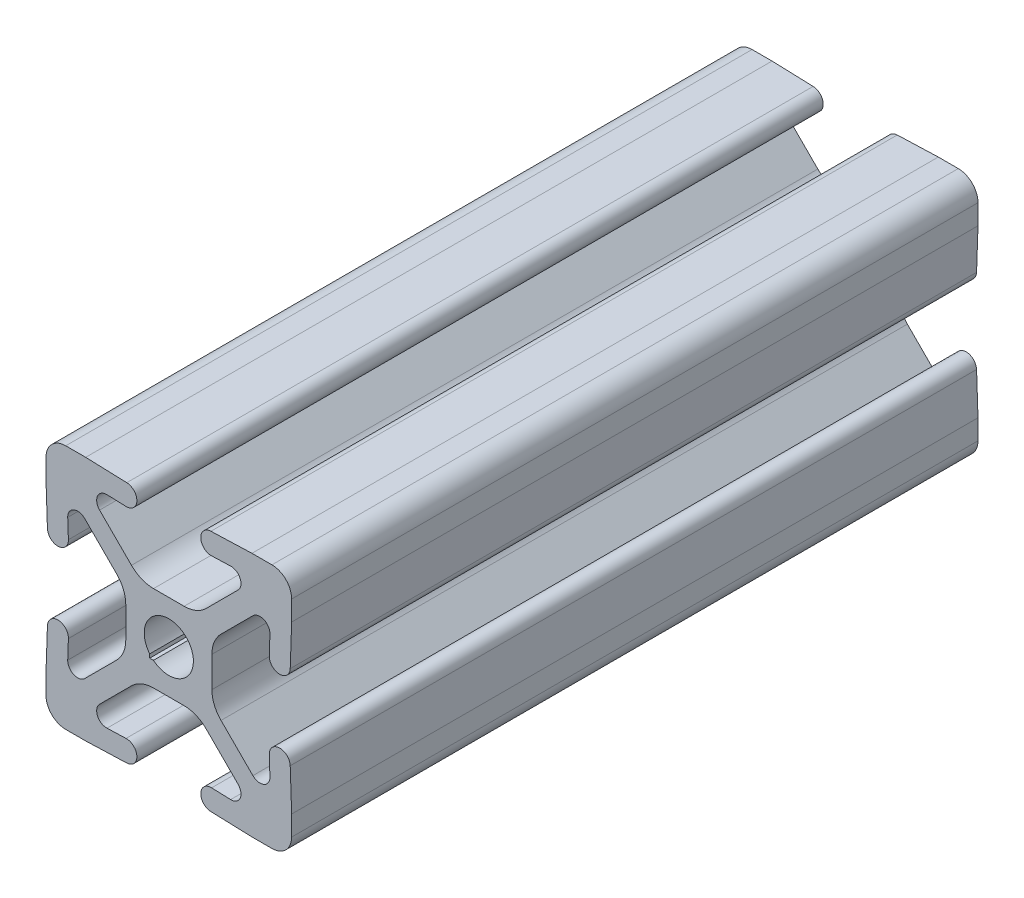
from build123d import *

# Parameters (mm, degrees)
BOSS_EXTRUDE1_DEPTH = 69.85


with BuildPart() as part:
    # Model → Boss-Extrude1 (new body)
    with BuildSketch(Plane.XY):
        with BuildLine():
            Line((50.659960212, 72.999871414), (53.774553856, 72.999871414))
            ThreePointArc((53.774553856, 72.999871414), (54.989573754, 72.758188929), (56.019617887, 72.069935444))
            Line((56.019617887, 72.069935444), (59.264200891, 68.825352439))
            ThreePointArc((59.264200891, 68.825352439), (59.477513437, 67.701802895), (58.510322513, 67.091550869))
            Line((58.510322513, 67.091550869), (56.572487817, 67.159221548))
            ThreePointArc((56.572487817, 67.159221548), (55.4691069, 66.130302197), (56.498026251, 65.026921279))
            Line((56.498026251, 65.026921279), (60.677257034, 64.880979325))
            Line((60.677257034, 64.880979325), (62.710657034, 64.880979325))
            ThreePointArc((62.710657034, 64.880979325), (64.129537501, 65.468698857), (64.717257034, 66.887579325))
            Line((64.717257034, 66.887579325), (64.717257034, 68.920979325))
            Line((64.717257034, 68.920979325), (64.57131508, 73.100210108))
            ThreePointArc((64.57131508, 73.100210108), (63.467934162, 74.129129459), (62.439014811, 73.025748542))
            Line((62.439014811, 73.025748542), (62.50668549, 71.087913846))
            ThreePointArc((62.50668549, 71.087913846), (61.896433464, 70.120722922), (60.77288392, 70.334035468))
            Line((60.77288392, 70.334035468), (57.528300915, 73.578618472))
            ThreePointArc((57.528300915, 73.578618472), (56.84004743, 74.608662605), (56.598364945, 75.823682503))
            Line((56.598364945, 75.823682503), (56.598364945, 78.938276147))
            ThreePointArc((56.598364945, 78.938276147), (56.84004743, 80.153296044), (57.528300915, 81.183340177))
            Line((57.528300915, 81.183340177), (60.77288392, 84.427923182))
            ThreePointArc((60.77288392, 84.427923182), (61.896433464, 84.641235728), (62.50668549, 83.674044803))
            Line((62.50668549, 83.674044803), (62.439014811, 81.736210108))
            ThreePointArc((62.439014811, 81.736210108), (63.467934162, 80.63282919), (64.57131508, 81.661748542))
            Line((64.57131508, 81.661748542), (64.717257034, 85.840979325))
            Line((64.717257034, 85.840979325), (64.717257034, 87.874379325))
            ThreePointArc((64.717257034, 87.874379325), (64.129537501, 89.293259792), (62.710657034, 89.880979325))
            Line((62.710657034, 89.880979325), (60.677257034, 89.880979325))
            Line((60.677257034, 89.880979325), (56.498026251, 89.73503737))
            ThreePointArc((56.498026251, 89.73503737), (55.4691069, 88.631656452), (56.572487817, 87.602737101))
            Line((56.572487817, 87.602737101), (58.510322513, 87.67040778))
            ThreePointArc((58.510322513, 87.67040778), (59.477513437, 87.060155754), (59.264200891, 85.93660621))
            Line((59.264200891, 85.93660621), (56.019617887, 82.692023205))
            ThreePointArc((56.019617887, 82.692023205), (54.989573754, 82.00376972), (53.774553856, 81.762087236))
            Line((53.774553856, 81.762087236), (50.659960212, 81.762087236))
            ThreePointArc((50.659960212, 81.762087236), (49.444940315, 82.00376972), (48.414896182, 82.692023205))
            Line((48.414896182, 82.692023205), (45.170313177, 85.93660621))
            ThreePointArc((45.170313177, 85.93660621), (44.957000631, 87.060155754), (45.924191556, 87.67040778))
            Line((45.924191556, 87.67040778), (47.862026251, 87.602737101))
            ThreePointArc((47.862026251, 87.602737101), (48.965407169, 88.631656452), (47.936487817, 89.73503737))
            Line((47.936487817, 89.73503737), (43.757257034, 89.880979325))
            Line((43.757257034, 89.880979325), (41.723857034, 89.880979325))
            ThreePointArc((41.723857034, 89.880979325), (40.304976567, 89.293259792), (39.717257034, 87.874379325))
            Line((39.717257034, 87.874379325), (39.717257034, 85.840979325))
            Line((39.717257034, 85.840979325), (39.863198989, 81.661748542))
            ThreePointArc((39.863198989, 81.661748542), (40.966579907, 80.63282919), (41.995499258, 81.736210108))
            Line((41.995499258, 81.736210108), (41.927828579, 83.674044803))
            ThreePointArc((41.927828579, 83.674044803), (42.538080605, 84.641235728), (43.661630149, 84.427923182))
            Line((43.661630149, 84.427923182), (46.906213154, 81.183340177))
            ThreePointArc((46.906213154, 81.183340177), (47.594466639, 80.153296044), (47.836149123, 78.938276147))
            Line((47.836149123, 78.938276147), (47.836149123, 75.823682503))
            ThreePointArc((47.836149123, 75.823682503), (47.594466639, 74.608662605), (46.906213154, 73.578618472))
            Line((46.906213154, 73.578618472), (43.661630149, 70.334035468))
            ThreePointArc((43.661630149, 70.334035468), (42.538080605, 70.120722922), (41.927828579, 71.087913846))
            Line((41.927828579, 71.087913846), (41.995499258, 73.025748542))
            ThreePointArc((41.995499258, 73.025748542), (40.966579907, 74.129129459), (39.863198989, 73.100210108))
            Line((39.863198989, 73.100210108), (39.717257034, 68.920979325))
            Line((39.717257034, 68.920979325), (39.717257034, 66.887579325))
            ThreePointArc((39.717257034, 66.887579325), (40.304976567, 65.468698857), (41.723857034, 64.880979325))
            Line((41.723857034, 64.880979325), (43.757257034, 64.880979325))
            Line((43.757257034, 64.880979325), (47.936487817, 65.026921279))
            ThreePointArc((47.936487817, 65.026921279), (48.965407169, 66.130302197), (47.862026251, 67.159221548))
            Line((47.862026251, 67.159221548), (45.924191556, 67.091550869))
            ThreePointArc((45.924191556, 67.091550869), (44.957000631, 67.701802895), (45.170313177, 68.825352439))
            Line((45.170313177, 68.825352439), (48.414896182, 72.069935444))
            ThreePointArc((48.414896182, 72.069935444), (49.444940315, 72.758188929), (50.659960212, 72.999871414))
        make_face()
        with BuildLine():
            Line((50.64953831, 75.433607249), (50.269884959, 75.433607249))
            Line((50.269884959, 75.433607249), (50.269884959, 75.8132606))
            ThreePointArc((50.269884959, 75.8132606), (53.985023987, 79.148746278), (50.64953831, 75.433607249))
        make_face(mode=Mode.SUBTRACT)
    extrude(amount=BOSS_EXTRUDE1_DEPTH)


solid = part.part
